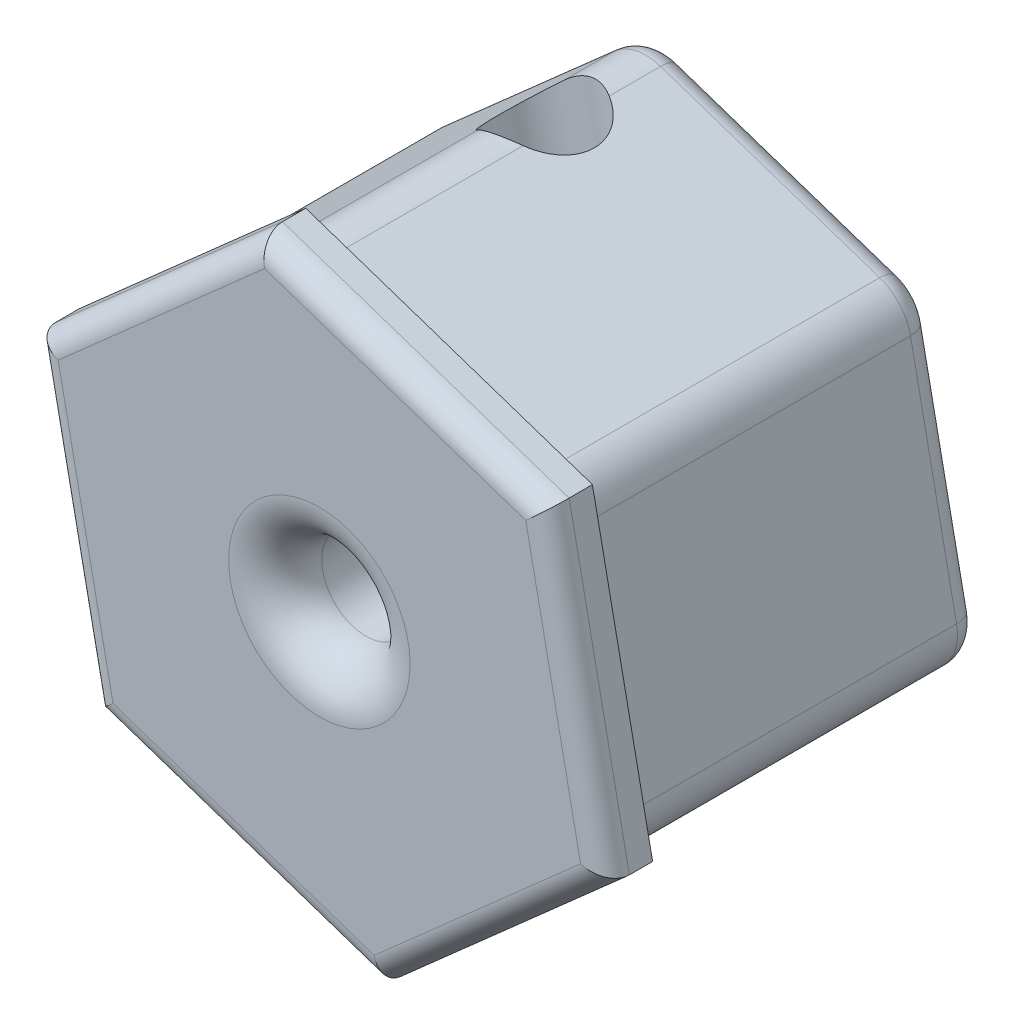
from build123d import *

# Parameters (mm, degrees)
DODANIE_WYCI_GNI_CIE1_DEPTH      = 17
ZAOKR_GLENIE1_R                  = 2
DODANIE_WYCI_GNI_CIE2_DEPTH      = 2
ZAOKR_GLENIE2_R                  = 1
ZAOKR_GLENIE3_R                  = 1
WYTNIJ_WYCI_GNI_CIE1_DEPTH       = 32.35628887
WYTNIJ_WYCI_GNI_CIE1_DEPTH_BACK  = 32.35628887
SZKIC4_R                         = 2.1
DODANIE_WYCI_GNI_CIE3_DEPTH      = 6
DODANIE_WYCI_GNI_CIE3_DEPTH_BACK = 6
SZKIC9_R                         = 2.1
SZKIC8_R                         = 1.9
WYTNIJ_WYCI_GNI_CIE3_DEPTH       = 10.5
ZAOKR_GLENIE5_R                  = 2
WYTNIJ_WYCI_GNI_CIE4_DEPTH       = 6.5
SZKIC12_R                        = 0.75
WYTNIJ_WYCI_GNI_CIE5_DEPTH       = 6.5


with BuildPart() as part:
    # Szkic1 → Dodanie-wyciągnięcie1 (new body)
    with BuildSketch(Plane.XY):
        Polygon((1.783068787, -4.564092652), (-0.653727134, 7.430712848), (-12.25993137, 11.317788426), (-21.429339686, 3.210058505), (-18.992543765, -8.784746995), (-7.386339528, -12.671822573), align=None)
    extrude(amount=DODANIE_WYCI_GNI_CIE1_DEPTH)

    # Zaokrąglenie1
    zaokr_glenie1_edges = [part.edges().sort_by_distance(p)[0] for p in [
        (-7.386339528, -12.671822573, 8.5),
        (-18.992543765, -8.784746995, 8.5),
        (-21.429339686, 3.210058505, 8.5),
        (-12.25993137, 11.317788426, 8.5),
        (-0.653727134, 7.430712848, 8.5),
        (1.783068787, -4.564092652, 8.5),
    ]]
    fillet(zaokr_glenie1_edges, radius=ZAOKR_GLENIE1_R)

    # Szkic3 → Dodanie-wyciągnięcie2 (add)
    with BuildSketch(Plane.XY.offset(17)):
        Polygon((-0.091452095, 7.927884965), (-12.409357535, 12.053318952), (-22.141040889, 3.448416913), (-19.554818803, -9.281919113), (-7.236913363, -13.407353099), (2.494769991, -4.80245106), align=None)
    extrude(amount=-DODANIE_WYCI_GNI_CIE2_DEPTH)

    # Zaokrąglenie2
    zaokr_glenie2_edges = [part.edges().sort_by_distance(p)[0] for p in [
        (-6.456829252, 9.374250637, 0),
        (-2.80163537, -8.617957613, 0),
        (-13.189441647, -10.728284784, 0),
        (-20.210941725, -2.787344245, 0),
        (-16.844635528, 7.263923465, 0),
        (0.564670827, 1.433310098, 0),
        (-12.198333493, 11.014581025, 0),
        (-21.135955436, 3.111800131, 0),
        (-18.760757392, -8.579797968, 0),
        (-7.447937406, -12.368615173, 0),
        (1.489684537, -4.465834278, 0),
        (-0.885513507, 7.225763821, 0),
    ]]
    fillet(zaokr_glenie2_edges, radius=ZAOKR_GLENIE2_R)

    # Zaokrąglenie3
    zaokr_glenie3_edges = [part.edges().sort_by_distance(p)[0] for p in [
        (1.201658948, 1.562716953, 17),
        (-6.250404815, 9.990601959, 17),
        (-17.275199212, 7.750867932, 17),
        (-20.847929846, -2.9167511, 17),
        (-13.395866083, -11.344636106, 17),
        (-2.371071686, -9.10490208, 17),
    ]]
    fillet(zaokr_glenie3_edges, radius=ZAOKR_GLENIE3_R)

    # Szkic4 → Wytnij-wyciągnięcie1 (cut, two sides: drawn at the far end of the back side and taken through both)
    with BuildSketch(Plane(origin=(-0.257260592, 1.266331223, 0), x_dir=(0.9799817241599056, 0.19908746899937949, 0), z_dir=(-0.19908746899937946, 0.9799817241599055, 0)).offset(-WYTNIJ_WYCI_GNI_CIE1_DEPTH_BACK)):
        with Locations(Location((-9.76127883, -5.05, 0), (0, 0, 241.563109851))):
            Circle(SZKIC4_R)
    extrude(amount=WYTNIJ_WYCI_GNI_CIE1_DEPTH + WYTNIJ_WYCI_GNI_CIE1_DEPTH_BACK, mode=Mode.SUBTRACT)

    # Szkic9 → Dodanie-wyciągnięcie3 (add, two sides: drawn at the far end of the back side and taken through both)
    with BuildSketch(Plane(origin=(-0.257260592, 1.266331223, 0), x_dir=(0.9799817241599056, 0.19908746899937949, 0), z_dir=(-0.19908746899937946, 0.9799817241599055, 0)).offset(-DODANIE_WYCI_GNI_CIE3_DEPTH_BACK)):
        with Locations(Location((-9.76127883, -5.05, 0), (0, 0, 180))):
            Circle(SZKIC9_R)
    extrude(amount=DODANIE_WYCI_GNI_CIE3_DEPTH + DODANIE_WYCI_GNI_CIE3_DEPTH_BACK)

    # Szkic8 → Wytnij-wyciągnięcie3 (cut)
    with BuildSketch(Plane.XY.offset(17)):
        with Locations((-9.823135449, -0.677017074)):
            Circle(SZKIC8_R)
    extrude(amount=-WYTNIJ_WYCI_GNI_CIE3_DEPTH, mode=Mode.SUBTRACT)

    # Zaokrąglenie5
    zaokr_glenie5_edges = [part.edges().sort_by_distance(p)[0] for p in [
        (-11.723135449, -0.677017074, 17),
    ]]
    fillet(zaokr_glenie5_edges, radius=ZAOKR_GLENIE5_R)

    # Szkic11 → Wytnij-wyciągnięcie4 (cut)
    with BuildSketch(Plane(origin=(0, 0, 0), x_dir=(-1, 0, 0), z_dir=(0, 0, -1))):
        Polygon((13.831970706, 1.978023394), (12.478175917, -4.68585233), (5.814300193, -3.332057541), (7.168094982, 3.331818183), align=None)
    extrude(amount=-WYTNIJ_WYCI_GNI_CIE4_DEPTH, mode=Mode.SUBTRACT)

    # Szkic12 → Wytnij-wyciągnięcie5 (cut)
    with BuildSketch(Plane(origin=(0, 0, 0), x_dir=(-1, 0, 0), z_dir=(0, 0, -1))):
        with Locations((13.831970706, 1.978023394)):
            Circle(SZKIC12_R)
        with Locations((12.478175917, -4.68585233)):
            Circle(SZKIC12_R)
        with Locations((5.814300193, -3.332057541)):
            Circle(SZKIC12_R)
        with Locations((7.168094982, 3.331818183)):
            Circle(SZKIC12_R)
    extrude(amount=-WYTNIJ_WYCI_GNI_CIE5_DEPTH, mode=Mode.SUBTRACT)


solid = part.part
